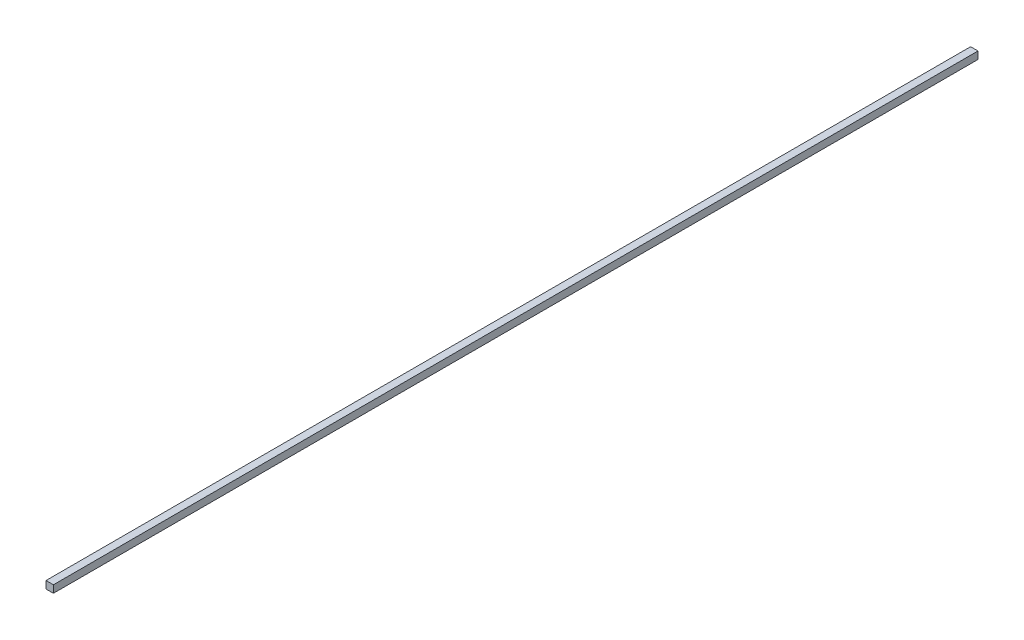
from build123d import *

# Parameters (mm, degrees)
SKETCH_1_W      = 20
SKETCH_1_H      = 20
EXTRUDE_1_DEPTH = 2500


with BuildPart() as part:
    # 草圖1 → 填料-伸長1 (new body)
    with BuildSketch(Plane.XY):
        with Locations((10, 10)):
            Rectangle(SKETCH_1_W, SKETCH_1_H)
    extrude(amount=EXTRUDE_1_DEPTH)


solid = part.part
